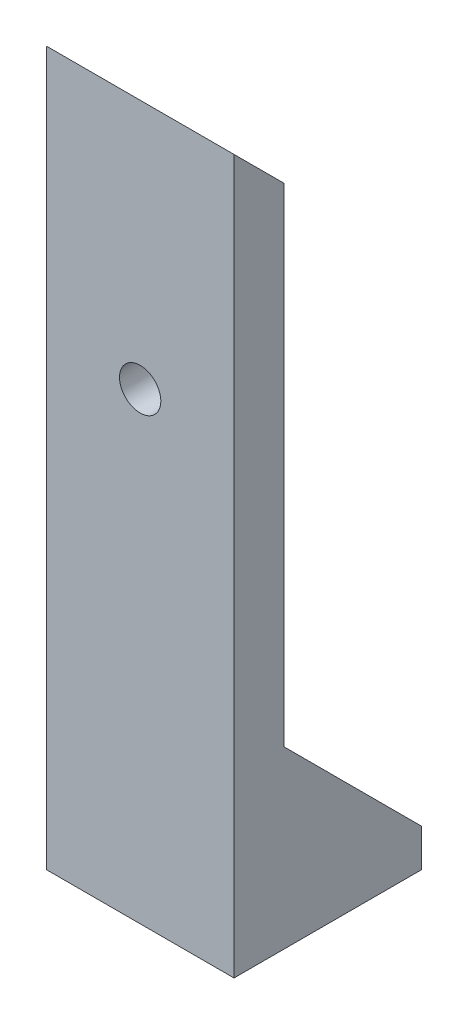
from build123d import *

# Parameters (mm, degrees)
SKETCH1_W           = 15
SKETCH1_H           = 15
SKETCH1_R           = 2.65
BOSS_EXTRUDE1_DEPTH = 3
SKETCH2_W           = 15
SKETCH2_H           = 4
BOSS_EXTRUDE2_DEPTH = 54
BOSS_EXTRUDE3_DEPTH = 3
SKETCH4_R           = 1.65
CUT_EXTRUDE1_DEPTH  = 13
CUT_EXTRUDE2_DEPTH  = 20


with BuildPart() as part:
    # Sketch1 → Boss-Extrude1 (new body)
    with BuildSketch(Plane(origin=(0, 0, 0), x_dir=(1, 0, 0), z_dir=(0, 1, 0))):
        with Locations((7.5, 7.5)):
            Rectangle(SKETCH1_W, SKETCH1_H)
        with Locations(Location((7.5, 9, 0), (0, 0, 270))):
            Circle(SKETCH1_R, mode=Mode.SUBTRACT)
    extrude(amount=BOSS_EXTRUDE1_DEPTH)

    # Sketch2 → Boss-Extrude2 (add)
    with BuildSketch(Plane(origin=(0, 3, 0), x_dir=(1, 0, 0), z_dir=(0, 1, 0))):
        with Locations((7.5, 2)):
            Rectangle(SKETCH2_W, SKETCH2_H)
    extrude(amount=BOSS_EXTRUDE2_DEPTH)

    # Sketch3 → Boss-Extrude3 (add)
    with BuildSketch(Plane(origin=(15, 0, 0), x_dir=(0, 0, -1), z_dir=(1, 0, 0))):
        Polygon((4, 14), (15, 3), (4, 3), align=None)
    boss_extrude3 = extrude(amount=-BOSS_EXTRUDE3_DEPTH)

    # Mirror1: Boss-Extrude3 across plane
    add(boss_extrude3.mirror(Plane.ZY.offset(-7.5)))

    # Sketch4 → Cut-Extrude1 (cut)
    with BuildSketch(Plane(origin=(0, 0, -4), x_dir=(-1, 0, 0), z_dir=(0, 0, -1))):
        with Locations((-7.5, 37)):
            Circle(SKETCH4_R)
    extrude(amount=-CUT_EXTRUDE1_DEPTH, mode=Mode.SUBTRACT)

    # Sketch5 → Cut-Extrude2 (cut)
    with BuildSketch(Plane(origin=(15, 0, 0), x_dir=(0, 0, -1), z_dir=(1, 0, 0))):
        Polygon((0, 57), (4, 53), (4, 57), align=None)
    extrude(amount=-CUT_EXTRUDE2_DEPTH, mode=Mode.SUBTRACT)


solid = part.part
